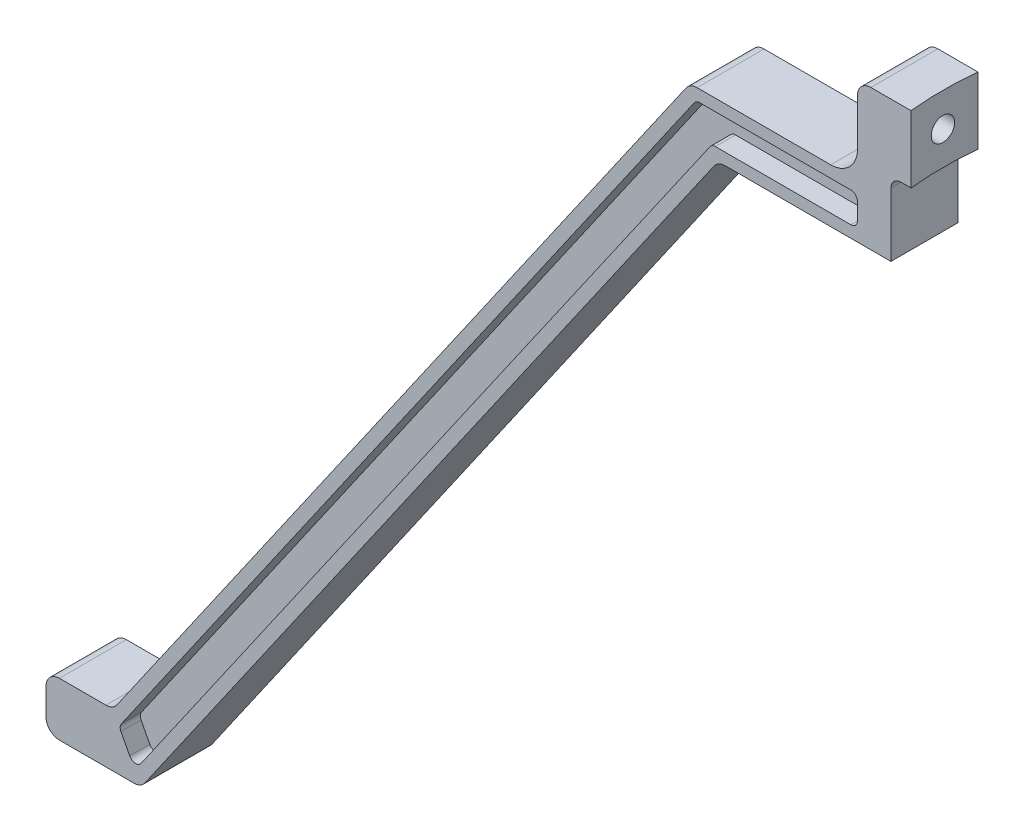
from build123d import *

# Parameters (mm, degrees)
BOSS_EXTRUDE1_DEPTH = 10
SKETCH2_R           = 1.75
CUT_EXTRUDE1_DEPTH  = 10
BOSS_EXTRUDE2_DEPTH = 5
CUT_EXTRUDE2_DEPTH  = 3
FILLET1_R           = 4
FILLET2_R           = 1.5
FILLET3_R           = 2
FILLET4_R           = 1


with BuildPart() as part:
    # Sketch1 → Boss-Extrude1 (new body)
    with BuildSketch(Plane(origin=(0, 0, 0), x_dir=(1, 0, 0), z_dir=(0, 1, 0))):
        with BuildLine():
            Line((-47.236109069, 5), (-55.236109069, 5))
            Line((-55.236109069, 5), (-55.236109069, -5))
            Line((-55.236109069, -5), (-47.236109069, -5))
            ThreePointArc((-47.236109069, -5), (-47.5, 0), (-47.236109069, 5))
        make_face()
    extrude(amount=-BOSS_EXTRUDE1_DEPTH)

    # Sketch2 → Cut-Extrude1 (cut)
    with BuildSketch(Plane.ZY.offset(55.236109069)):
        with Locations((0, -5)):
            Circle(SKETCH2_R)
    extrude(amount=-CUT_EXTRUDE1_DEPTH, mode=Mode.SUBTRACT)

    # Sketch3 → Boss-Extrude2 (add, symmetric)
    with BuildSketch(Plane.XY):
        Polygon((-80.236109069, -13), (-166.418406548, -137), (-176.418406548, -137), (-176.418406548, -145), (-162.236109069, -145), (-76.053811591, -21), (-50.236109069, -21), (-50.236109069, -10), (-55.236109069, -10), (-55.236109069, -13), align=None)
    extrude(amount=BOSS_EXTRUDE2_DEPTH, both=True)

    # Sketch4 → Cut-Extrude2 (cut)
    with BuildSketch(Plane.XY.offset(5)):
        Polygon((-164.327257809, -141), (-165.503528974, -138.75), (-79.321231496, -14.75), (-55.236109069, -14.75), (-55.236109069, -19.25), (-76.968689164, -19.25), (-163.150986643, -143.25), align=None)
    cut_extrude2 = extrude(amount=-CUT_EXTRUDE2_DEPTH, mode=Mode.SUBTRACT)

    # Mirror1: Cut-Extrude2 across plane
    add(cut_extrude2.mirror(Plane.XY), mode=Mode.SUBTRACT)

    # Fillet1
    fillet1_edges = [part.edges().sort_by_distance(p)[0] for p in [
        (-55.236109069, -13, 0),
    ]]
    fillet(fillet1_edges, radius=FILLET1_R)

    # Fillet2
    fillet2_edges = [part.edges().sort_by_distance(p)[0] for p in [
        (-50.236109069, -10, 0),
    ]]
    fillet(fillet2_edges, radius=FILLET2_R)

    # Fillet3
    fillet3_edges = [part.edges().sort_by_distance(p)[0] for p in [
        (-80.236109069, -13, 0),
        (-166.418406548, -137, 0),
        (-176.418406548, -137, 0),
        (-176.418406548, -145, 0),
        (-162.236109069, -145, 0),
        (-76.053811591, -21, 0),
        (-55.236109069, 0, 0),
    ]]
    fillet(fillet3_edges, radius=FILLET3_R)

    # Fillet4
    fillet4_edges = [part.edges().sort_by_distance(p)[0] for p in [
        (-55.236109069, -14.75, 3.5),
        (-55.236109069, -19.25, 3.5),
        (-76.968689164, -19.25, 3.5),
        (-163.150986643, -143.25, 3.5),
        (-165.503528974, -138.75, 3.5),
        (-79.321231496, -14.75, 3.5),
        (-55.236109069, -19.25, -3.5),
        (-55.236109069, -14.75, -3.5),
        (-79.321231496, -14.75, -3.5),
        (-165.503528974, -138.75, -3.5),
        (-163.150986643, -143.25, -3.5),
        (-76.968689164, -19.25, -3.5),
    ]]
    fillet(fillet4_edges, radius=FILLET4_R)


solid = part.part
